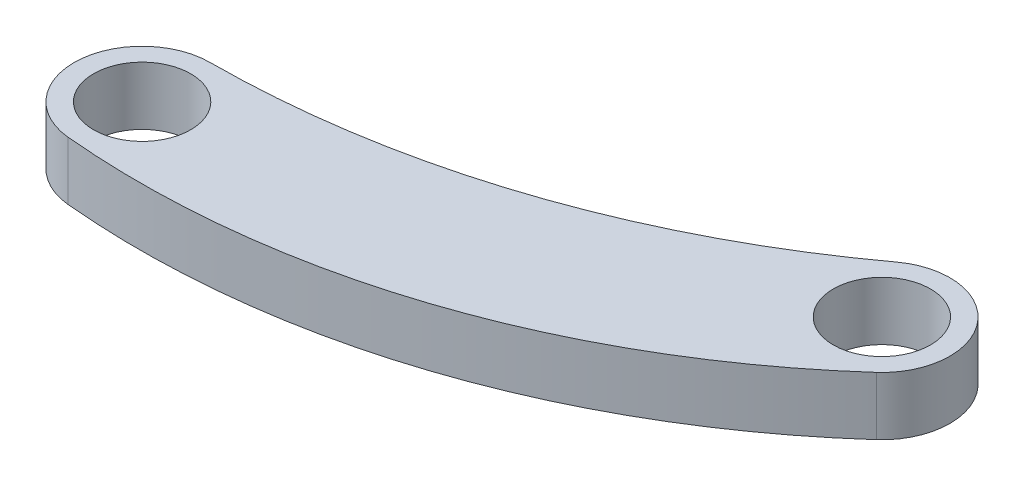
from build123d import *

# Parameters (mm, degrees)
EXTRUDE_1_DEPTH     = 3
SKETCH_2_R          = 2.5
CUT_EXTRUDE_1_DEPTH = 3


with BuildPart() as part:
    # 草图1 → 凸台-拉伸1 (new body)
    with BuildSketch(Plane(origin=(0, 0, 0), x_dir=(1, 0, 0), z_dir=(0, 1, 0))):
        with BuildLine():
            ThreePointArc((6.796232726, -80.103971167), (3.309364716, -83.445468492), (6.479618851, -87.088728243))
            ThreePointArc((6.479618851, -87.088728243), (23.201931583, -85.196198653), (37.766812343, -76.765204654))
            ThreePointArc((37.766812343, -76.765204654), (38.146329718, -71.950662158), (33.355557274, -71.3404554))
            ThreePointArc((33.355557274, -71.3404554), (20.773998873, -77.837935766), (6.796232726, -80.103971167))
        make_face()
    extrude(amount=EXTRUDE_1_DEPTH)

    # 草图2 → 切除-拉伸1 (cut)
    with BuildSketch(Plane(origin=(0, 0, 0), x_dir=(1, 0, 0), z_dir=(0, 1, 0))):
        with Locations(Location((6.805774449, -83.603958161, 0), (0, 0, 270))):
            Circle(SKETCH_2_R)
        with Locations(Location((35.430824241, -74.158835612, 0), (0, 0, 270))):
            Circle(SKETCH_2_R)
    extrude(amount=CUT_EXTRUDE_1_DEPTH, mode=Mode.SUBTRACT)


solid = part.part
